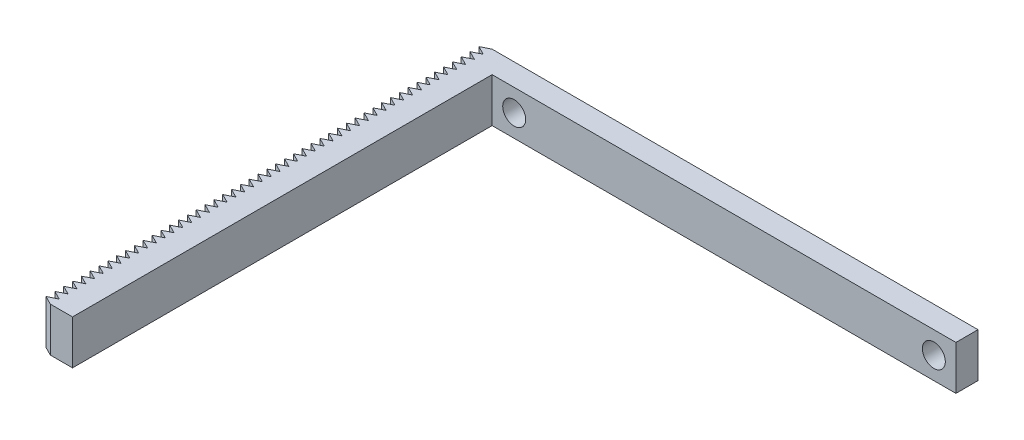
from build123d import *

# Parameters (mm, degrees)
SKETCH1_W           = 133.35
SKETCH1_H           = 12.7
SKETCH1_R           = 3.302
BOSS_EXTRUDE1_DEPTH = 3.175
BOSS_EXTRUDE2_START = -3.175
SKETCH2_W           = 6.35
SKETCH2_H           = 12.7
BOSS_EXTRUDE2_DEPTH = 127
BOSS_EXTRUDE3_DEPTH = 12.7
LPATTERN1_COUNT     = 50
LPATTERN1_PITCH     = 2.54


with BuildPart() as part:
    # Sketch1 → Boss-Extrude1 (new, symmetric)
    with BuildSketch(Plane.XY):
        Rectangle(SKETCH1_W, SKETCH1_H)
        with Locations((-60.325, 0)):
            Circle(SKETCH1_R, mode=Mode.SUBTRACT)
        with Locations(Location((60.325, 0, 0), (0, 0, 180))):
            Circle(SKETCH1_R, mode=Mode.SUBTRACT)
    extrude(amount=BOSS_EXTRUDE1_DEPTH, both=True)

    # Sketch2 → Boss-Extrude2 (add)
    with BuildSketch(Plane.XY.offset(BOSS_EXTRUDE2_START)):
        with Locations((-69.85, 0)):
            Rectangle(SKETCH2_W, SKETCH2_H)
    extrude(amount=BOSS_EXTRUDE2_DEPTH)

    # Sketch4 → Boss-Extrude3 (add)
    with BuildSketch(Plane(origin=(0, 6.35, 0), x_dir=(1, 0, 0), z_dir=(0, 1, 0))):
        Polygon((-73.025, 3.175), (-75.565, 1.905), (-73.025, 0.635), align=None)
    boss_extrude3 = extrude(amount=-BOSS_EXTRUDE3_DEPTH)

    # LPattern1: Boss-Extrude3 ×50
    with Locations(*[(0, 0, i * LPATTERN1_PITCH) for i in range(1, LPATTERN1_COUNT)]):
        add(boss_extrude3)


solid = part.part
